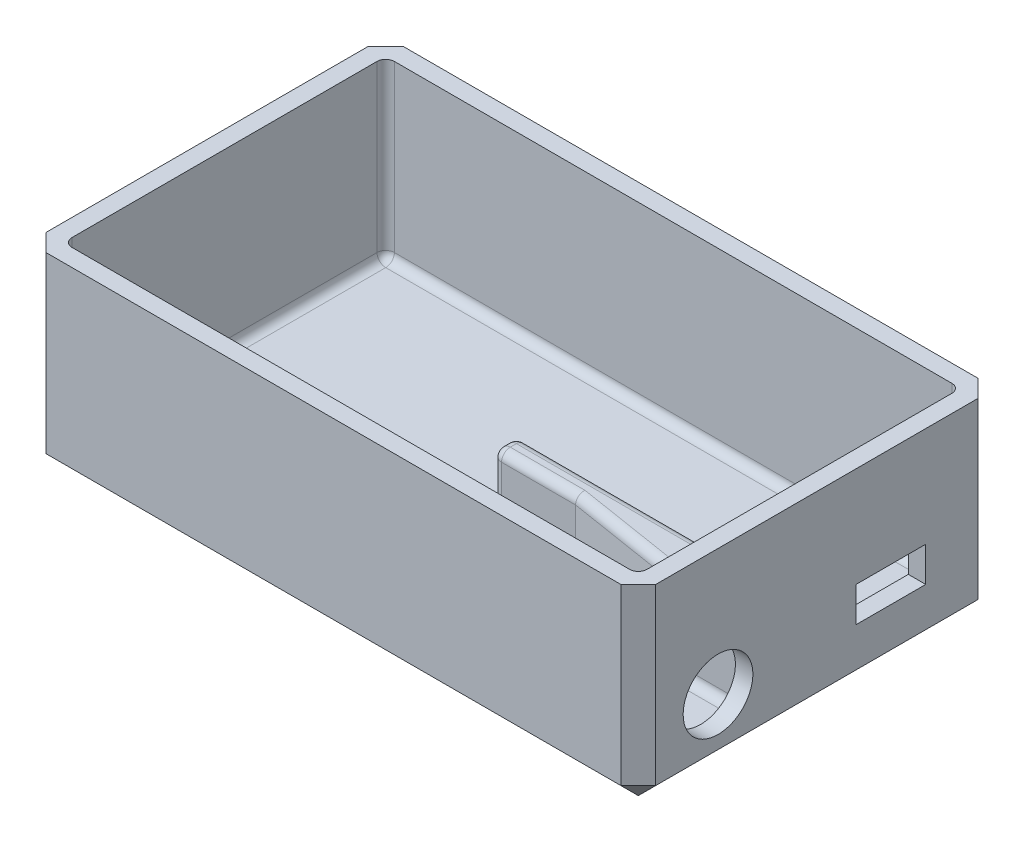
from build123d import *

# Parameters (mm, degrees)
ESQUISSE1_W             = 70
ESQUISSE1_H             = 41
BOSS_EXTRU_1_DEPTH      = 22
COQUE1_T                = -2
BOSS_EXTRU_2_DEPTH      = 10
ENL_V_MAT_EXTRU_1_REACH = 76.352
ESQUISSE3_R             = 4
ESQUISSE3_W             = 8
ESQUISSE3_H             = 4
ENL_V_MAT_EXTRU_2_REACH = 76.352
ESQUISSE4_R             = 3.5
CONG_1_R                = 1
CHANFREIN1_SIZE         = 2


with BuildPart() as part:
    # Esquisse1 → Boss.-Extru.1 (new body)
    with BuildSketch(Plane(origin=(0, 0, 0), x_dir=(1, 0, 0), z_dir=(0, 1, 0))):
        Rectangle(ESQUISSE1_W, ESQUISSE1_H)
    extrude(amount=BOSS_EXTRU_1_DEPTH)

    # Coque1
    coque1_openings = [part.faces().sort_by_distance(p)[0] for p in [
        (0, 22, 0),
    ]]
    offset(amount=COQUE1_T, openings=coque1_openings, kind=Kind.INTERSECTION)

    # Esquisse2 → Boss.-Extru.2 (add)
    with BuildSketch(Plane(origin=(0, 2, 0), x_dir=(1, 0, 0), z_dir=(0, 1, 0))):
        Polygon((33, -16.5), (24, -16.5), (11.5, -18.5), (33, -18.5), align=None)
        Polygon((33, -6.2), (24, -6.2), (11.5, -4.2), (2, -4.2), (2, -1.5), (33, -1.5), align=None)
    extrude(amount=BOSS_EXTRU_2_DEPTH)

    # Esquisse3 → Enlèv. mat.-Extru.1 (cut, up to next)
    with BuildSketch(Plane.ZY.offset(-33), mode=Mode.PRIVATE) as enl_v_mat_extru_1_sk1:
        with Locations((11.35, 7.5)):
            Circle(ESQUISSE3_R)
    enl_v_mat_extru_1_tool1 = extrude(enl_v_mat_extru_1_sk1.sketch, amount=-ENL_V_MAT_EXTRU_1_REACH, mode=Mode.PRIVATE) & part.part
    # Esquisse3 → Enlèv. mat.-Extru.1 (cut, up to next)
    with BuildSketch(Plane.ZY.offset(-33), mode=Mode.PRIVATE) as enl_v_mat_extru_1_sk2:
        with Locations((-8.5, 8.5)):
            Rectangle(ESQUISSE3_W, ESQUISSE3_H)
    enl_v_mat_extru_1_tool2 = extrude(enl_v_mat_extru_1_sk2.sketch, amount=-ENL_V_MAT_EXTRU_1_REACH, mode=Mode.PRIVATE) & part.part
    add(enl_v_mat_extru_1_tool1.solids().sort_by_distance((33, 7.5, 11.35))[0], mode=Mode.SUBTRACT)
    add(enl_v_mat_extru_1_tool2.solids().sort_by_distance((33, 8.5, -8.5))[0], mode=Mode.SUBTRACT)

    # Esquisse4 → Enlèv. mat.-Extru.2 (cut, up to next)
    with BuildSketch(Plane(origin=(-33, 0, 0), x_dir=(0, 0, -1), z_dir=(1, 0, 0)), mode=Mode.PRIVATE) as enl_v_mat_extru_2_sk1:
        with Locations((-11.35, 7.5)):
            Circle(ESQUISSE4_R)
    enl_v_mat_extru_2_tool1 = extrude(enl_v_mat_extru_2_sk1.sketch, amount=-ENL_V_MAT_EXTRU_2_REACH, mode=Mode.PRIVATE) & part.part
    add(enl_v_mat_extru_2_tool1.solids().sort_by_distance((-33, 7.5, 11.35))[0], mode=Mode.SUBTRACT)

    # Congé1
    cong_1_edges = [part.edges().sort_by_distance(p)[0] for p in [
        (33, 17, 18.5),
        (0, 2, -18.5),
        (33, 12, -18.5),
        (-33, 2, 0),
        (-33, 12, -18.5),
        (-10.75, 2, 18.5),
        (-33, 12, 18.5),
        (33, 2, 11.35),
        (28.5, 2, 16.5),
        (33, 7, 16.5),
        (17.75, 2, 17.5),
        (33, 12, 17.5),
        (22.25, 12, 18.5),
        (33, 2, -8.5),
        (33, 7, 6.2),
        (17.5, 2, 1.5),
        (33, 7, 1.5),
        (2, 2, 2.85),
        (2, 7, 1.5),
        (6.75, 2, 4.2),
        (2, 7, 4.2),
        (17.75, 2, 5.2),
        (28.5, 2, 6.2),
        (33, 12, 3.85),
        (17.5, 12, 1.5),
        (2, 12, 2.85),
        (6.75, 12, 4.2),
        (17.75, 12, 5.2),
        (28.5, 12, 6.2),
    ]]
    fillet(cong_1_edges, radius=CONG_1_R)

    # Chanfrein1
    chanfrein1_edges = [part.edges().sort_by_distance(p)[0] for p in [
        (0, 0, 20.5),
        (-35, 0, 0),
        (0, 0, -20.5),
        (35, 0, 0),
        (35, 11, 20.5),
        (-35, 11, 20.5),
        (-35, 11, -20.5),
        (35, 11, -20.5),
    ]]
    chamfer(chanfrein1_edges, length=CHANFREIN1_SIZE)


solid = part.part
